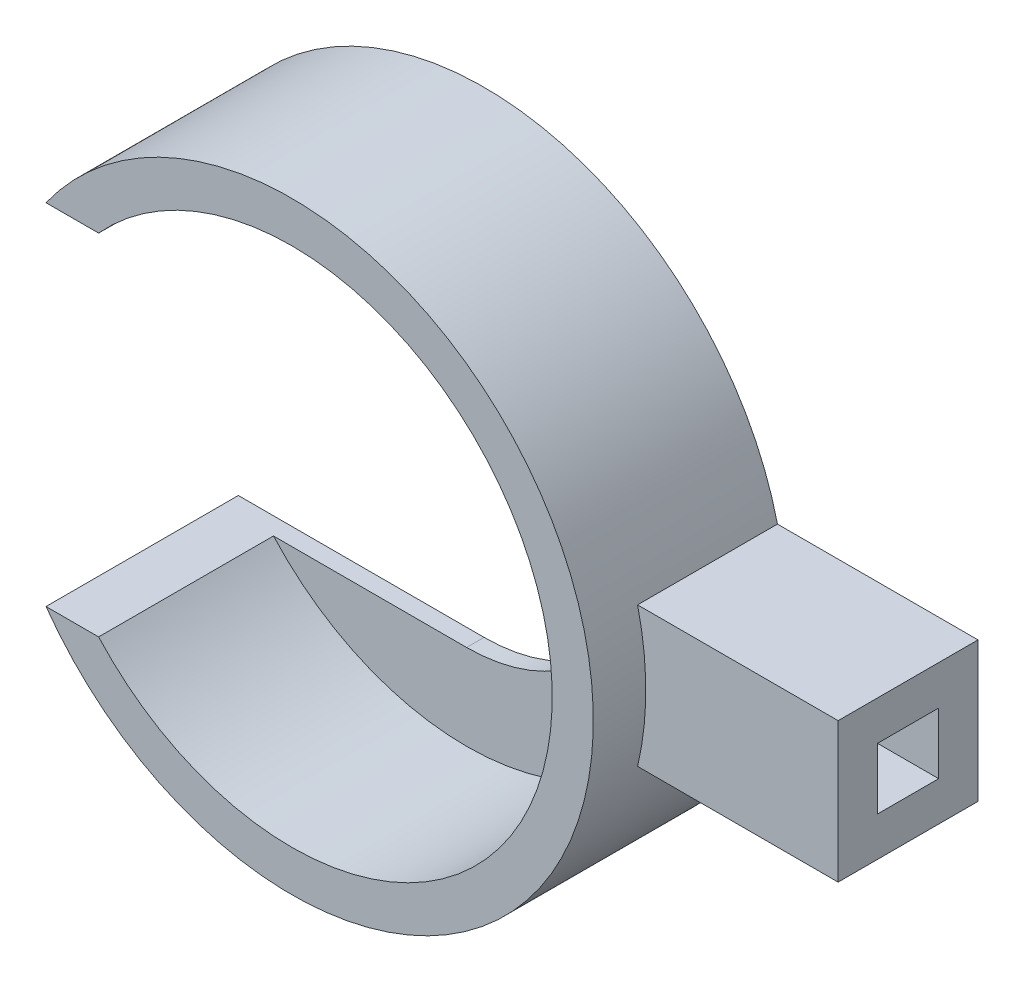
from build123d import *

# Parameters (mm, degrees)
SKETCH1_R                = 17.25
SKETCH1_R_2              = 14.9
BOSS_EXTRUDE1_DEPTH      = 10
BOSS_EXTRUDE3_START      = 1
SKETCH2_R                = 17.25
SKETCH2_R_2              = 10
BOSS_EXTRUDE3_DEPTH      = 1
SKETCH3_R                = 10
CUT_EXTRUDE1_DEPTH       = 27.760511953
BOSS_EXTRUDE4_DEPTH      = 11
BOSS_EXTRUDE4_DEPTH_BACK = 1.5
SKETCH4_W                = 3.5
SKETCH4_H                = 3.5
CUT_EXTRUDE2_DEPTH       = 3.5


with BuildPart() as part:
    # Sketch1 → Boss-Extrude1 (new body)
    with BuildSketch(Plane.XY):
        Circle(SKETCH1_R)
        Circle(SKETCH1_R_2, mode=Mode.SUBTRACT)
    extrude(amount=BOSS_EXTRUDE1_DEPTH)

    # Sketch2 → Boss-Extrude3 (add)
    with BuildSketch(Plane(origin=(0, 0, 0), x_dir=(-1, 0, 0), z_dir=(0, 0, -1)).offset(BOSS_EXTRUDE3_START)):
        Circle(SKETCH2_R)
        Circle(SKETCH2_R_2, mode=Mode.SUBTRACT)
    extrude(amount=-BOSS_EXTRUDE3_DEPTH)

    # Sketch3 → Cut-Extrude1 (cut, through all)
    with BuildSketch(Plane(origin=(0, 0, -1), x_dir=(-1, 0, 0), z_dir=(0, 0, -1))):
        Circle(SKETCH3_R)
        with BuildLine():
            Line((14.055692797, 10), (0, 10))
            ThreePointArc((0, 10), (7.071067812, 7.071067812), (10, 0))
            ThreePointArc((10, 0), (7.071067812, -7.071067812), (0, -10))
            Line((0, -10), (14.055692797, -10))
            ThreePointArc((14.055692797, -10), (16.432029709, -5.248895086), (17.25, 0))
            ThreePointArc((17.25, 0), (16.432029709, 5.248895086), (14.055692797, 10))
        make_face()
    extrude(amount=-CUT_EXTRUDE1_DEPTH, mode=Mode.SUBTRACT)

    # 3DSketch1 → Boss-Extrude4 (add, two sides: drawn at the far end of the back side and taken through both)
    with BuildSketch(Plane(origin=(17.25, 0, -1), x_dir=(0, 0.4472135954999581, 0.8944271909999159), z_dir=(1, 0, 0)).offset(-BOSS_EXTRUDE4_DEPTH_BACK)):
        Polygon((0, 0), (-1.788854382, 3.577708764), (5.366563146, 7.155417528), (8.94427191, 0), (1.788854382, -3.577708764), align=None)
    extrude(amount=BOSS_EXTRUDE4_DEPTH + BOSS_EXTRUDE4_DEPTH_BACK)

    # Sketch4 → Cut-Extrude2 (cut)
    with BuildSketch(Plane(origin=(28.25, 0, 0), x_dir=(0, 0, -1), z_dir=(1, 0, 0))):
        with Locations((-3, 0)):
            Rectangle(SKETCH4_W, SKETCH4_H)
    extrude(amount=-CUT_EXTRUDE2_DEPTH, mode=Mode.SUBTRACT)


solid = part.part
